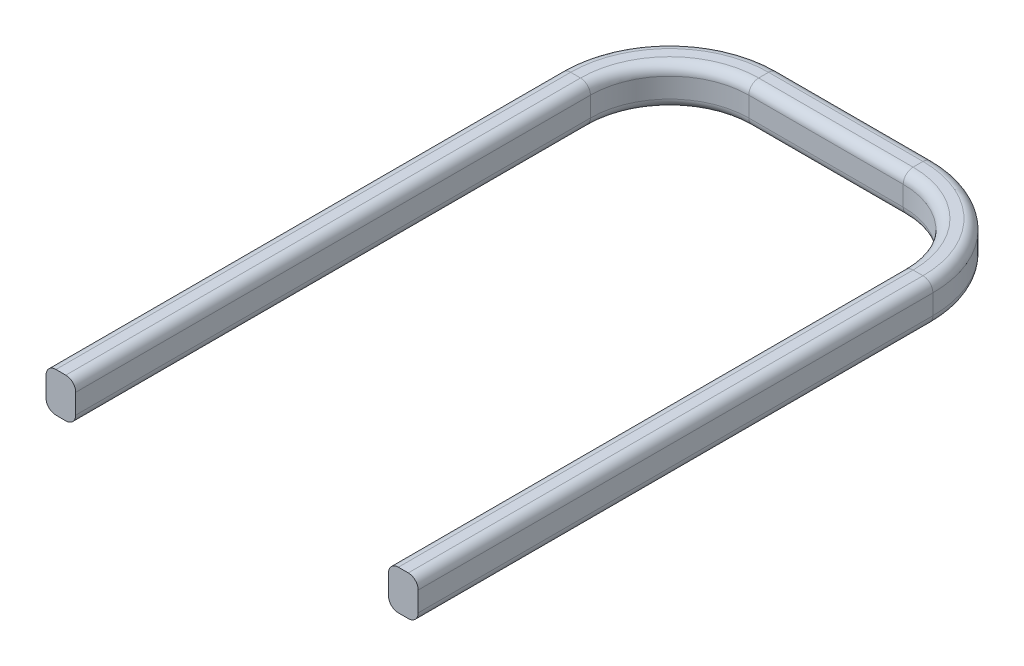
from build123d import *

# Parameters (mm, degrees)
SKETCH3_W    = 0.75
SKETCH3_H    = 1
FILLET1_R    = 0.25
SCALE1_SCALE = 0.445


with BuildPart() as part:
    # Sweep1: sweep along a path in Sketch2
    with BuildLine(Plane(origin=(0, 0, 0), x_dir=(1, 0, 0), z_dir=(0, 1, 0))) as sweep1_path:
        Line((-3.95, 0), (-3.95, 13))
        ThreePointArc((-3.95, 13), (-3.364213562, 14.414213562), (-1.95, 15))
        Line((-1.95, 15), (1.95, 15))
        ThreePointArc((1.95, 15), (3.364213562, 14.414213562), (3.95, 13))
        Line((3.95, 13), (3.95, 0))
    # Sketch3 → Sweep1 (sweep)
    with BuildSketch(Plane.XY):
        with Locations((-4.325, 0.5)):
            Rectangle(SKETCH3_W, SKETCH3_H)
    sweep(path=sweep1_path.line)

    # Fillet1
    fillet1_edges = [part.edges().sort_by_distance(p)[0] for p in [
        (3.95, 1, -6.5),
        (4.7, 1, -6.5),
        (4.7, 0, -6.5),
        (-3.95, 0, -6.5),
        (-3.95, 1, -6.5),
        (-4.7, 1, -6.5),
        (-4.7, 0, -6.5),
        (-3.364213562, 0, -14.414213562),
        (-3.364213562, 1, -14.414213562),
        (-3.894543648, 1, -14.944543648),
        (-3.894543648, 0, -14.944543648),
        (0, 0, -15),
        (0, 1, -15),
        (0, 1, -15.75),
        (0, 0, -15.75),
        (3.364213562, 0, -14.414213562),
        (3.364213562, 1, -14.414213562),
        (3.894543648, 1, -14.944543648),
        (3.894543648, 0, -14.944543648),
        (3.95, 0, -6.5),
    ]]
    fillet(fillet1_edges, radius=FILLET1_R)


with BuildPart() as part_1:
    # Scale1: scaled about (0, 0.5, -9.028741483)
    add(part.part.scale(SCALE1_SCALE).moved(Location((0, 0.2775, -5.010951523))))


solid = part_1.part
